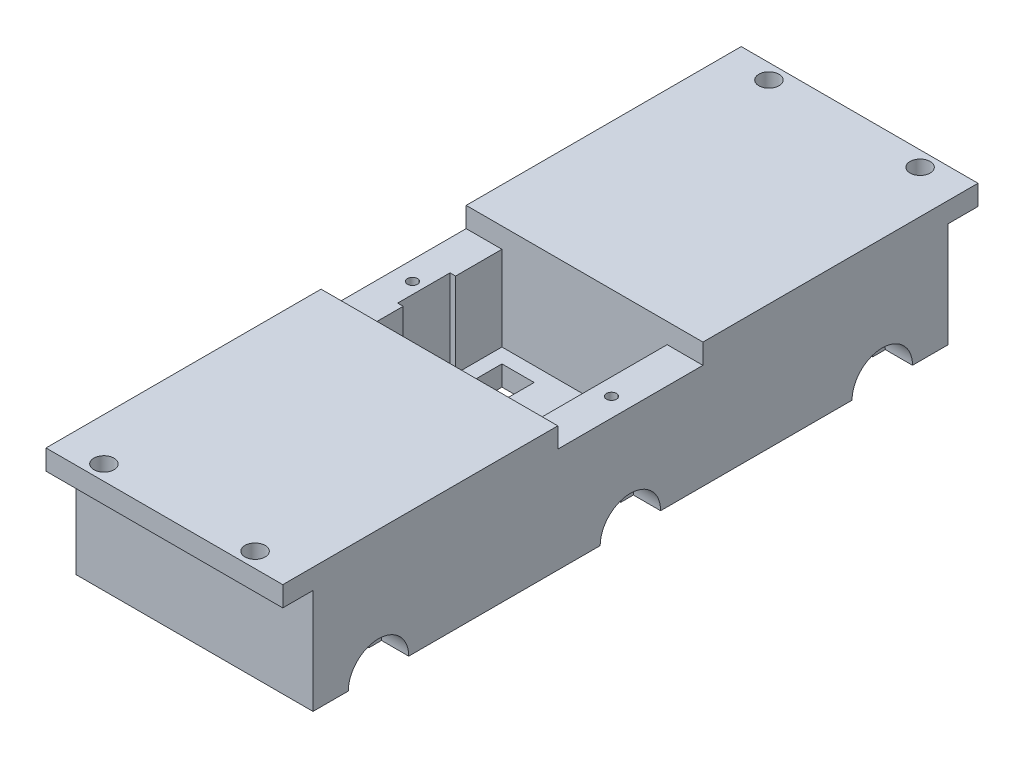
from build123d import *

# Parameters (mm, degrees)
SKETCH_4_W                = 46
SKETCH_4_H                = 107.5
EXTRUDE_1_DEPTH           = 3
SKETCH_5_W                = 23.5
SKETCH_5_H                = 63
EXTRUDE_2_DEPTH           = 12.4
SKETCH_6_R                = 1.75
CUT_EXTRUDE_1_DEPTH       = 66.1949768
SKETCH_6_3_R              = 3
CUT_EXTRUDE_2_DEPTH       = 2.7
CUT_EXTRUDE_START         = -20.8
SKETCH_6_4_R              = 3
CUT_EXTRUDE_3_DEPTH       = 2.7
SKETCH_6_5_R              = 3
CUT_EXTRUDE_4_DEPTH       = 2.7
SKETCH_6_6_R              = 3
CUT_EXTRUDE_5_DEPTH       = 2.7
SKETCH_7_R                = 0.7
CUT_EXTRUDE_6_DEPTH       = 2
CUT_EXTRUDE_START_2       = -2
SKETCH_8_W                = 16.4
SKETCH_8_H                = 14.4
CUT_EXTRUDE_7_DEPTH       = 59.458436136
SKETCH_9_W                = 46
SKETCH_9_H                = 8
EXTRUDE_3_DEPTH           = 10
SKETCH_9_3_W              = 3
SKETCH_9_3_H              = 91.5
EXTRUDE_4_DEPTH           = 3
SKETCH_10_R               = 0.6
CUT_EXTRUDE_8_DEPTH       = 2
SKETCH_11_W               = 26.4
SKETCH_11_H               = 14.4
CUT_EXTRUDE_9_DEPTH       = 5
SKETCH_12_R               = 0.5
CUT_EXTRUDE_10_DEPTH      = 2
CUT_EXTRUDE_11_DEPTH      = 61.458436136
CUT_EXTRUDE_12_DEPTH      = 90.164580972
CUT_EXTRUDE_12_DEPTH_BACK = 90.164580972
SKETCH_14_W               = 46
SKETCH_14_H               = 3
SKETCH_15_OUTSIDE_W       = 71.516
SKETCH_15_OUTSIDE_H       = 133.016
SKETCH_15_OUTSIDE_W_2     = 23.5
SKETCH_15_OUTSIDE_H_2     = 63
CUT_EXTRUDE_15_DEPTH      = 60.764726219
SKETCH_16_W               = 23.5
SKETCH_16_H               = 3
SKETCH_16_R               = 1
EXTRUDE_5_DEPTH           = 2
CUT_EXTRUDE_START_3       = -1
SKETCH_17_R               = 5.75
CUT_EXTRUDE_16_DEPTH      = 3.4
CUT_EXTRUDE_START_4       = 0.4
SKETCH_18_R               = 8.25
CUT_EXTRUDE_17_DEPTH      = 2
SKETCH_19_R               = 3.25
CUT_EXTRUDE_18_DEPTH      = 4
SKETCH_20_R               = 5.75
CUT_EXTRUDE_19_DEPTH      = 3.4
CUT_EXTRUDE_START_5       = -4.7
SKETCH_21_R               = 1
CUT_EXTRUDE_20_DEPTH      = 3
CUT_EXTRUDE_START_6       = -10.7
SKETCH_21_2_R             = 1
CUT_EXTRUDE_21_DEPTH      = 3


with BuildPart() as part:
    # 草图4 → 凸台-拉伸1 (new body)
    with BuildSketch(Plane(origin=(0, 0, 0), x_dir=(1, 0, 0), z_dir=(0, 1, 0))):
        Rectangle(SKETCH_4_W, SKETCH_4_H)
    extrude(amount=EXTRUDE_1_DEPTH)

    # 草图5 → 凸台-拉伸2 (add)
    with BuildSketch(Plane.XZ):
        Rectangle(SKETCH_5_W, SKETCH_5_H)
    extrude(amount=EXTRUDE_2_DEPTH)

    # 草图6 → 切除-拉伸1 (cut, through all)
    with BuildSketch(Plane.ZY.offset(11.75)):
        with Locations((0, -12.4)):
            Circle(SKETCH_6_R)
        with Locations((25, -12.4)):
            Circle(SKETCH_6_R)
        with Locations((-25, -12.4)):
            Circle(SKETCH_6_R)
    extrude(amount=-CUT_EXTRUDE_1_DEPTH, mode=Mode.SUBTRACT)

    # 草图6<3> → 切除-拉伸2 (cut)
    with BuildSketch(Plane.ZY.offset(11.75)):
        with Locations((0, -12.4)):
            Circle(SKETCH_6_3_R)
    extrude(amount=-CUT_EXTRUDE_2_DEPTH, mode=Mode.SUBTRACT)

    # 草图6<4> → 切除-拉伸3 (cut)
    with BuildSketch(Plane.ZY.offset(11.75).offset(CUT_EXTRUDE_START)):
        with Locations((0, -12.4)):
            Circle(SKETCH_6_4_R)
    extrude(amount=-CUT_EXTRUDE_3_DEPTH, mode=Mode.SUBTRACT)

    # 草图6<5> → 切除-拉伸4 (cut)
    with BuildSketch(Plane.ZY.offset(11.75)):
        with Locations((25, -12.4)):
            Circle(SKETCH_6_5_R)
        with Locations((-25, -12.4)):
            Circle(SKETCH_6_5_R)
    extrude(amount=-CUT_EXTRUDE_4_DEPTH, mode=Mode.SUBTRACT)

    # 草图6<6> → 切除-拉伸5 (cut)
    with BuildSketch(Plane.ZY.offset(11.75).offset(CUT_EXTRUDE_START)):
        with Locations((25, -12.4)):
            Circle(SKETCH_6_6_R)
        with Locations((-25, -12.4)):
            Circle(SKETCH_6_6_R)
    extrude(amount=-CUT_EXTRUDE_5_DEPTH, mode=Mode.SUBTRACT)

    # 草图7 → 切除-拉伸6 (cut)
    with BuildSketch(Plane(origin=(0, -12.4, 0), x_dir=(-1, 0, 0), z_dir=(0, -1, 0))):
        with Locations(Location((9.249949764, -20, 0), (0, 0, 90))):
            Circle(SKETCH_7_R)
        with Locations(Location((-9.249949764, -20, 0), (0, 0, 90))):
            Circle(SKETCH_7_R)
        with Locations(Location((-9.249949764, -6, 0), (0, 0, 90))):
            Circle(SKETCH_7_R)
        with Locations(Location((9.249949764, -6, 0), (0, 0, 90))):
            Circle(SKETCH_7_R)
        with Locations(Location((9.249949764, 6, 0), (0, 0, 90))):
            Circle(SKETCH_7_R)
        with Locations(Location((-9.249949764, 6, 0), (0, 0, 90))):
            Circle(SKETCH_7_R)
        with Locations(Location((-9.249949764, 20, 0), (0, 0, 90))):
            Circle(SKETCH_7_R)
        with Locations(Location((9.249949764, 20, 0), (0, 0, 90))):
            Circle(SKETCH_7_R)
    extrude(amount=-CUT_EXTRUDE_6_DEPTH, mode=Mode.SUBTRACT)

    # 草图8 → 切除-拉伸7 (cut, through all)
    with BuildSketch(Plane.XZ.offset(12.4).offset(CUT_EXTRUDE_START_2)):
        Rectangle(SKETCH_8_W, SKETCH_8_H)
    extrude(amount=-CUT_EXTRUDE_7_DEPTH, mode=Mode.SUBTRACT)

    # 草图9 → 凸台-拉伸3 (add)
    with BuildSketch(Plane.XZ):
        with Locations((0, 49.75)):
            Rectangle(SKETCH_9_W, SKETCH_9_H)
        with Locations((0, -49.75)):
            Rectangle(SKETCH_9_W, SKETCH_9_H)
    extrude(amount=EXTRUDE_3_DEPTH)

    # 草图9<3> → 凸台-拉伸4 (add)
    with BuildSketch(Plane.XZ):
        with Locations((-21.5, 0)):
            Rectangle(SKETCH_9_3_W, SKETCH_9_3_H)
        with Locations((21.5, 0)):
            Rectangle(SKETCH_9_3_W, SKETCH_9_3_H)
    extrude(amount=EXTRUDE_4_DEPTH)

    # 草图10 → 切除-拉伸8 (cut)
    with BuildSketch(Plane.XY.offset(53.75)):
        with Locations((-7.5, 0)):
            Circle(SKETCH_10_R)
        with Locations((7.5, 0)):
            Circle(SKETCH_10_R)
    extrude(amount=-CUT_EXTRUDE_8_DEPTH, mode=Mode.SUBTRACT)

    # 草图11 → 切除-拉伸9 (cut)
    with BuildSketch(Plane(origin=(0, 3, 0), x_dir=(1, 0, 0), z_dir=(0, 1, 0))):
        Rectangle(SKETCH_11_W, SKETCH_11_H)
    extrude(amount=-CUT_EXTRUDE_9_DEPTH, mode=Mode.SUBTRACT)

    # 草图12 → 切除-拉伸10 (cut)
    with BuildSketch(Plane(origin=(0, -2, 0), x_dir=(1, 0, 0), z_dir=(0, 1, 0))):
        with Locations(Location((-9.875, 0, 0), (0, 0, 270))):
            Circle(SKETCH_12_R)
        with Locations(Location((9.875, 0, 0), (0, 0, 270))):
            Circle(SKETCH_12_R)
    extrude(amount=-CUT_EXTRUDE_10_DEPTH, mode=Mode.SUBTRACT)

    # 草图13 → 切除-拉伸11 (cut, through all)
    with BuildSketch(Plane.XZ.offset(12.4)):
        Polygon((-8.75, 2.6), (-6.75, 2.6), (-6.75, 5.75), (-3.55, 5.75), (-3.55, -5.75), (-6.75, -5.75), (-6.75, -2.6), (-8.75, -2.6), align=None)
    extrude(amount=-CUT_EXTRUDE_11_DEPTH, mode=Mode.SUBTRACT)

    # 草图14 → 切除-拉伸12 (cut, two sides: drawn at the far end of the back side and taken through both)
    with BuildSketch(Plane.XY.offset(31.5).offset(-CUT_EXTRUDE_12_DEPTH_BACK)):
        with Locations((0, 1.5)):
            Rectangle(SKETCH_14_W, SKETCH_14_H)
    extrude(amount=CUT_EXTRUDE_12_DEPTH + CUT_EXTRUDE_12_DEPTH_BACK, mode=Mode.SUBTRACT)


with BuildPart() as cut_extrude_12_piece_1:
    # of the separate pieces the step leaves, piece 1, a body of its own (cut_extrude_12_pieces)
    add(part.part.solids().sort_by_distance((-11.75, 0, 31.5))[0])

    # 草图16 → 凸台-拉伸5 (add)
    # profile 1 of 2: a face of its own
    with BuildSketch(Plane(origin=(0, 0, 0), x_dir=(1, 0, 0), z_dir=(0, 1, 0))):
        with Locations((0, 33)):
            Rectangle(SKETCH_16_W, SKETCH_16_H)
        with Locations(Location((-7.5, 33, 0), (0, 0, 270))):
            Circle(SKETCH_16_R, mode=Mode.SUBTRACT)
        with Locations(Location((7.5, 33, 0), (0, 0, 270))):
            Circle(SKETCH_16_R, mode=Mode.SUBTRACT)
    # profile 2 of 2: a face of its own
    with BuildSketch(Plane(origin=(0, 0, 0), x_dir=(1, 0, 0), z_dir=(0, 1, 0))):
        with Locations((0, -33)):
            Rectangle(SKETCH_16_W, SKETCH_16_H)
        with Locations(Location((-7.5, -33, 0), (0, 0, 270))):
            Circle(SKETCH_16_R, mode=Mode.SUBTRACT)
        with Locations(Location((7.5, -33, 0), (0, 0, 270))):
            Circle(SKETCH_16_R, mode=Mode.SUBTRACT)
    extrude(amount=-EXTRUDE_5_DEPTH)

    # 草图17 → 切除-拉伸16 (cut)
    with BuildSketch(Plane(origin=(9.05, 0, 0), x_dir=(0, 0, -1), z_dir=(1, 0, 0)).offset(CUT_EXTRUDE_START_3)):
        with Locations((0, -12.4)):
            Circle(SKETCH_17_R)
    extrude(amount=-CUT_EXTRUDE_16_DEPTH, mode=Mode.SUBTRACT)

    # 草图18 → 切除-拉伸17 (cut)
    with BuildSketch(Plane(origin=(4.65, 0, 0), x_dir=(0, 0, -1), z_dir=(1, 0, 0)).offset(CUT_EXTRUDE_START_4)):
        with Locations((-12.5, -12.4)):
            Circle(SKETCH_18_R)
        with Locations((12.5, -12.4)):
            Circle(SKETCH_18_R)
    extrude(amount=CUT_EXTRUDE_17_DEPTH, mode=Mode.SUBTRACT)

    # 草图19 → 切除-拉伸18 (cut)
    with BuildSketch(Plane(origin=(5.05, 0, 0), x_dir=(0, 0, -1), z_dir=(1, 0, 0))):
        with Locations((-12.5, -12.4)):
            Circle(SKETCH_19_R)
        with Locations((12.5, -12.4)):
            Circle(SKETCH_19_R)
    extrude(amount=-CUT_EXTRUDE_18_DEPTH, mode=Mode.SUBTRACT)

    # 草图20 → 切除-拉伸19 (cut)
    with BuildSketch(Plane.ZY.offset(-7.05)):
        with Locations((-25, -12.4)):
            Circle(SKETCH_20_R)
        with Locations((25, -12.4)):
            Circle(SKETCH_20_R)
    extrude(amount=CUT_EXTRUDE_19_DEPTH, mode=Mode.SUBTRACT)

    # 草图21 → 切除-拉伸20 (cut)
    with BuildSketch(Plane(origin=(11.75, 0, 0), x_dir=(0, 0, -1), z_dir=(1, 0, 0)).offset(CUT_EXTRUDE_START_5)):
        with Locations((-12.5, -12.4)):
            Circle(SKETCH_21_R)
        with Locations((12.5, -12.4)):
            Circle(SKETCH_21_R)
    extrude(amount=CUT_EXTRUDE_20_DEPTH, mode=Mode.SUBTRACT)

    # 草图21<2> → 切除-拉伸21 (cut)
    with BuildSketch(Plane(origin=(11.75, 0, 0), x_dir=(0, 0, -1), z_dir=(1, 0, 0)).offset(CUT_EXTRUDE_START_6)):
        with Locations((-12.5, -12.4)):
            Circle(SKETCH_21_2_R)
        with Locations((12.5, -12.4)):
            Circle(SKETCH_21_2_R)
    extrude(amount=-CUT_EXTRUDE_21_DEPTH, mode=Mode.SUBTRACT)


with BuildPart() as cut_extrude_12_piece_2:
    # of the separate pieces the step leaves, piece 2, a body of its own (cut_extrude_12_pieces)
    add(part.part.solids().sort_by_distance((-23, 0, 53.75))[0])

    # 草图15 outside → 切除-拉伸15 (cut, through all)
    with BuildSketch(Plane.XZ.offset(12.4)):
        Rectangle(SKETCH_15_OUTSIDE_W, SKETCH_15_OUTSIDE_H)
        Rectangle(SKETCH_15_OUTSIDE_W_2, SKETCH_15_OUTSIDE_H_2, mode=Mode.SUBTRACT)
    extrude(amount=-CUT_EXTRUDE_15_DEPTH, mode=Mode.SUBTRACT)


solid = cut_extrude_12_piece_1.part
